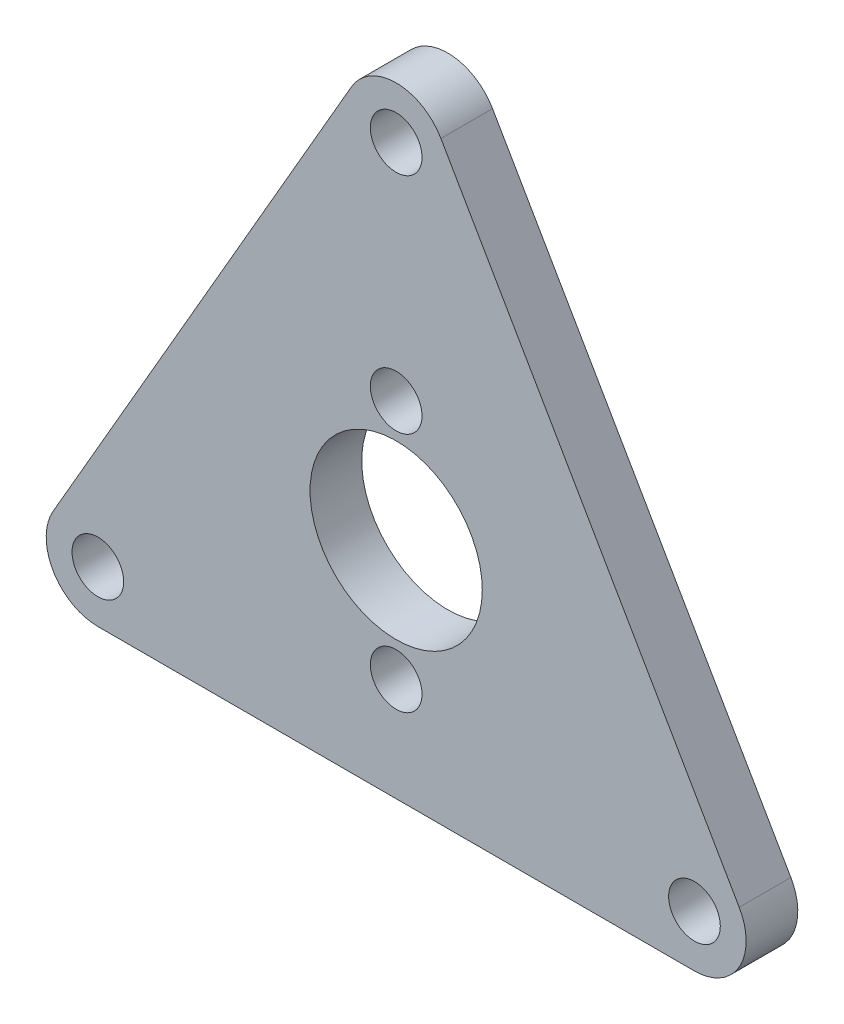
from build123d import *

# Parameters (mm, degrees)
SKETCH_1_R      = 1.5
SKETCH_1_R_2    = 5
EXTRUDE_1_DEPTH = 3


with BuildPart() as part:
    # 草图1 → 凸台-拉伸1 (new body)
    with BuildSketch(Plane.XY):
        with BuildLine():
            Line((-2.598076211, 21.5), (-19.918584287, -8.5))
            ThreePointArc((-19.918584287, -8.5), (-19.918584287, -11.5), (-17.320508076, -13))
            Line((-17.320508076, -13), (17.320508076, -13))
            ThreePointArc((17.320508076, -13), (19.918584287, -11.5), (19.918584287, -8.5))
            Line((19.918584287, -8.5), (2.598076211, 21.5))
            ThreePointArc((2.598076211, 21.5), (0, 23), (-2.598076211, 21.5))
        make_face()
        with Locations((-17.320508076, -10)):
            Circle(SKETCH_1_R, mode=Mode.SUBTRACT)
        with Locations((0, 20)):
            Circle(SKETCH_1_R, mode=Mode.SUBTRACT)
        with Locations((17.320508076, -10)):
            Circle(SKETCH_1_R, mode=Mode.SUBTRACT)
        Circle(SKETCH_1_R_2, mode=Mode.SUBTRACT)
        with Locations((0, 7)):
            Circle(SKETCH_1_R, mode=Mode.SUBTRACT)
        with Locations((0, -7)):
            Circle(SKETCH_1_R, mode=Mode.SUBTRACT)
    extrude(amount=EXTRUDE_1_DEPTH)


solid = part.part
